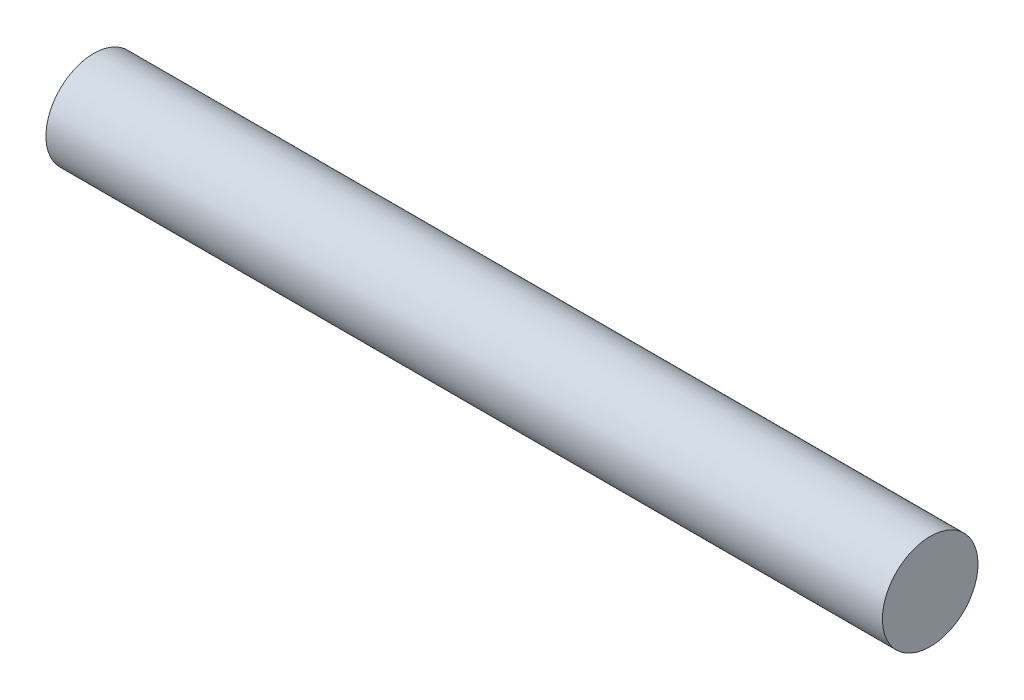
from build123d import *

# Parameters (mm, degrees)
SKETCH1_R           = 8
BOSS_EXTRUDE1_DEPTH = 140


with BuildPart() as part:
    # Sketch1 → Boss-Extrude1 (new body)
    with BuildSketch(Plane(origin=(0, 0, 0), x_dir=(0, 0, -1), z_dir=(1, 0, 0))):
        Circle(SKETCH1_R)
    extrude(amount=BOSS_EXTRUDE1_DEPTH)


solid = part.part
